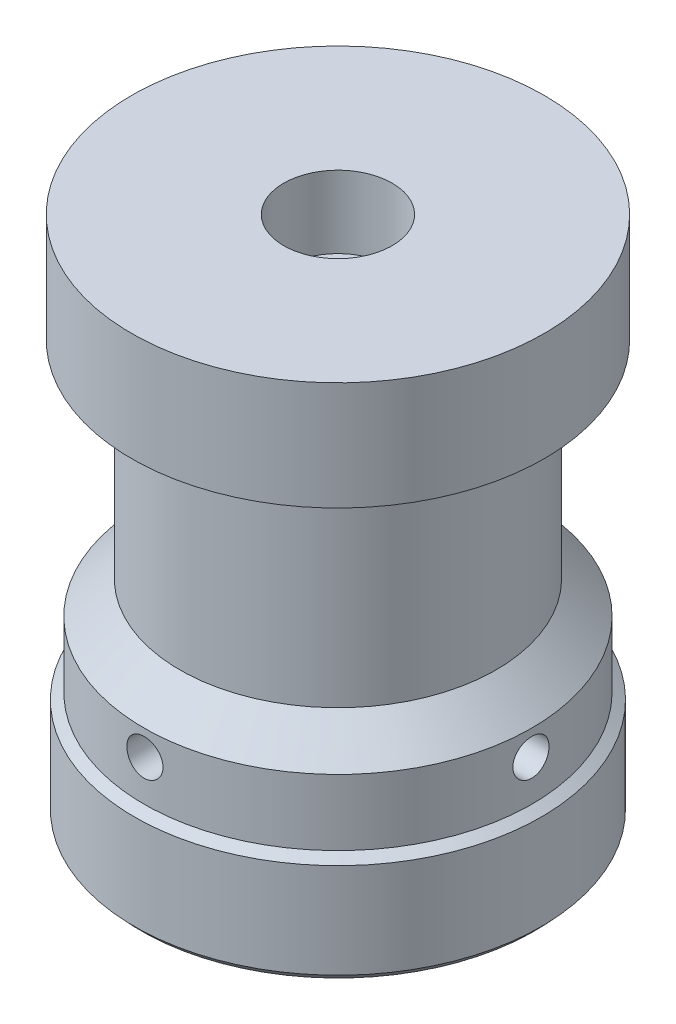
from build123d import *

# Parameters (mm, degrees)
SKETCH2_W          = 6
SKETCH2_H          = 7
CUT_EXTRUDE1_DEPTH = 41.4
SKETCH3_R          = 2
CUT_EXTRUDE2_DEPTH = 29
SKETCH4_R          = 2
CUT_EXTRUDE3_DEPTH = 29


with BuildPart() as part:
    # Sketch1 → Revolve1 (revolve)
    with BuildSketch(Plane.XY, mode=Mode.PRIVATE) as revolve1_sk:
        Polygon((11, 0), (11, 41.4), (3.25, 41.4), (3.25, 49.8), (6, 49.8), (6, 57.8), (22.825, 57.8), (22.825, 45.8), (17.5, 45.8), (17.5, 22.9), (21.45, 19.3), (21.45, 12), (22.5, 11.3), (22.5, 0.8), (21.75, 0), align=None)
    revolve(revolve1_sk.sketch.rotate(Axis((0, 0, 0), (0, 1, 0)), 90), axis=Axis((0, 0, 0), (0, 1, 0)))

    # Sketch2 → Cut-Extrude1 (cut)
    with BuildSketch(Plane.XZ):
        with Locations((0, 10.5)):
            Rectangle(SKETCH2_W, SKETCH2_H)
    extrude(amount=-CUT_EXTRUDE1_DEPTH, mode=Mode.SUBTRACT)

    # Sketch3 → Cut-Extrude2 (cut)
    with BuildSketch(Plane.XY.offset(22)):
        with Locations((0, 16.5)):
            Circle(SKETCH3_R)
    extrude(amount=-CUT_EXTRUDE2_DEPTH, mode=Mode.SUBTRACT)

    # Sketch4 → Cut-Extrude3 (cut)
    with BuildSketch(Plane(origin=(22, 0, 0), x_dir=(0, 0, -1), z_dir=(1, 0, 0))):
        with Locations((0, 16.5)):
            Circle(SKETCH4_R)
    extrude(amount=-CUT_EXTRUDE3_DEPTH, mode=Mode.SUBTRACT)


solid = part.part
